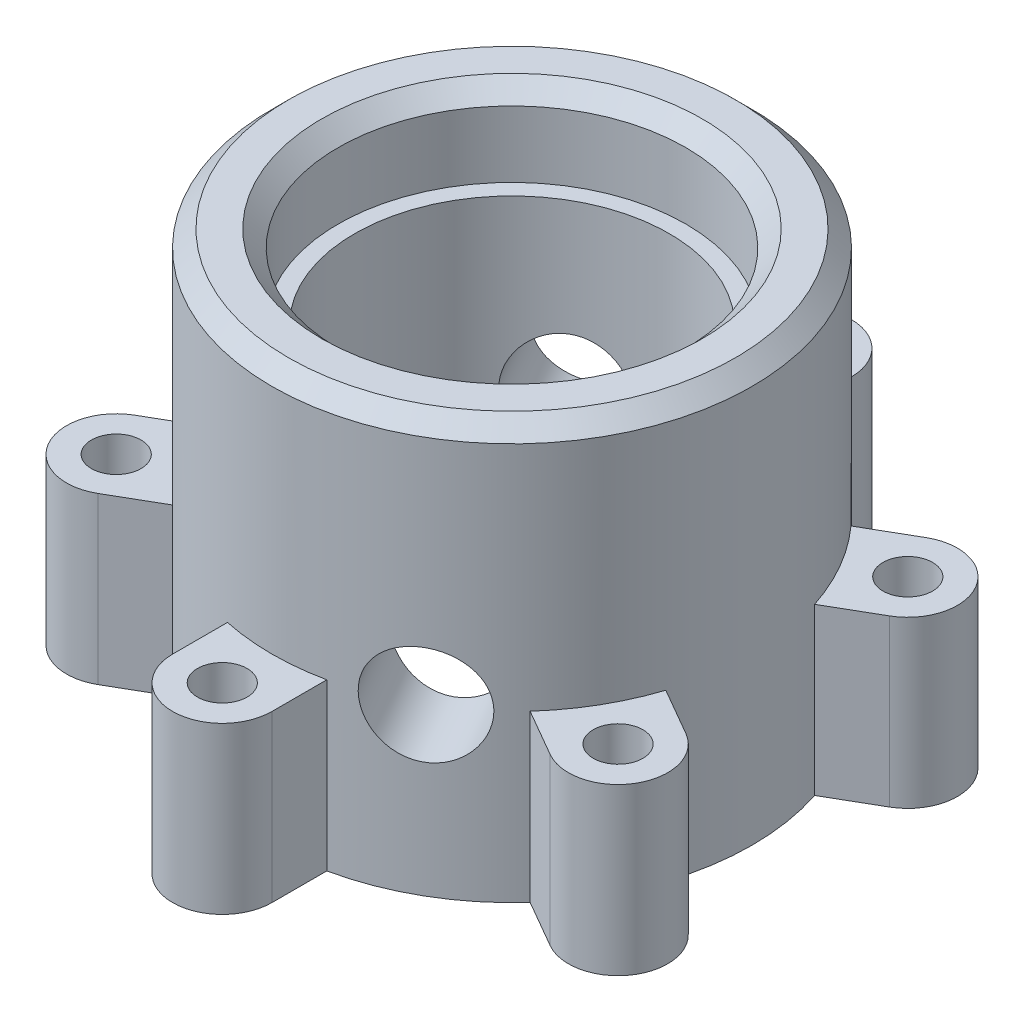
from build123d import *

# Parameters (mm, degrees)
SKETCH1_R           = 14.5
SKETCH1_R_2         = 9.5
BOSS_EXTRUDE1_DEPTH = 25
SKETCH2_R           = 1.5
BOSS_EXTRUDE2_DEPTH = 10
CIRPATTERN1_COUNT   = 6
SKETCH3_R           = 10.5
CUT_EXTRUDE1_DEPTH  = 5
CHAMFER1_SIZE       = 1
CHAMFER2_SIZE       = 1
SKETCH5_R           = 3
CUT_EXTRUDE2_DEPTH  = 32


with BuildPart() as part:
    # Sketch1 → Boss-Extrude1 (new body)
    with BuildSketch(Plane(origin=(0, 0, 0), x_dir=(1, 0, 0), z_dir=(0, 1, 0))):
        with Locations(Location((0, 0, 0), (0, 0, 270))):
            Circle(SKETCH1_R)
        with Locations(Location((0, 0, 0), (0, 0, 270))):
            Circle(SKETCH1_R_2, mode=Mode.SUBTRACT)
    extrude(amount=BOSS_EXTRUDE1_DEPTH)

    # Sketch2 → Boss-Extrude2 (add)
    with BuildSketch(Plane.XZ):
        with BuildLine():
            Line((-3, 13.002684968), (-3, 17.5))
            ThreePointArc((-3, 17.5), (0, 20.5), (3, 17.5))
            Line((3, 17.5), (3, 13.002684968))
            Line((3, 13.002684968), (-3, 13.002684968))
        make_face()
        with Locations(Location((0, 17.5, 0), (0, 0, 270))):
            Circle(SKETCH2_R, mode=Mode.SUBTRACT)
    boss_extrude2 = extrude(amount=-BOSS_EXTRUDE2_DEPTH)

    # CirPattern1: Boss-Extrude2 ×6 about axis
    cirpattern1_axis = Axis((0, 0, 0), (0, 1, 0))
    for i in range(1, CIRPATTERN1_COUNT):
        add(boss_extrude2.rotate(cirpattern1_axis, i * 360 / CIRPATTERN1_COUNT))

    # Sketch3 → Cut-Extrude1 (cut)
    with BuildSketch(Plane(origin=(0, 25, 0), x_dir=(1, 0, 0), z_dir=(0, 1, 0))):
        with Locations(Location((0, 0, 0), (0, 0, 270))):
            Circle(SKETCH3_R)
    extrude(amount=-CUT_EXTRUDE1_DEPTH, mode=Mode.SUBTRACT)

    # Chamfer1
    chamfer1_edges = [part.edges().sort_by_distance(p)[0] for p in [
        (0, 25, -10.5),
    ]]
    chamfer(chamfer1_edges, length=CHAMFER1_SIZE)

    # Chamfer2
    chamfer2_edges = [part.edges().sort_by_distance(p)[0] for p in [
        (0, 25, -14.5),
    ]]
    chamfer(chamfer2_edges, length=CHAMFER2_SIZE)

    # Sketch5 → Cut-Extrude2 (cut)
    with BuildSketch(Plane(origin=(7.25, 25, 12.557368355), x_dir=(0.8660254037844379, 0, -0.5000000000000013), z_dir=(0.5000000000000013, 0, 0.8660254037844379))):
        with Locations((0, -15)):
            Circle(SKETCH5_R)
    extrude(amount=-CUT_EXTRUDE2_DEPTH, mode=Mode.SUBTRACT)


solid = part.part
